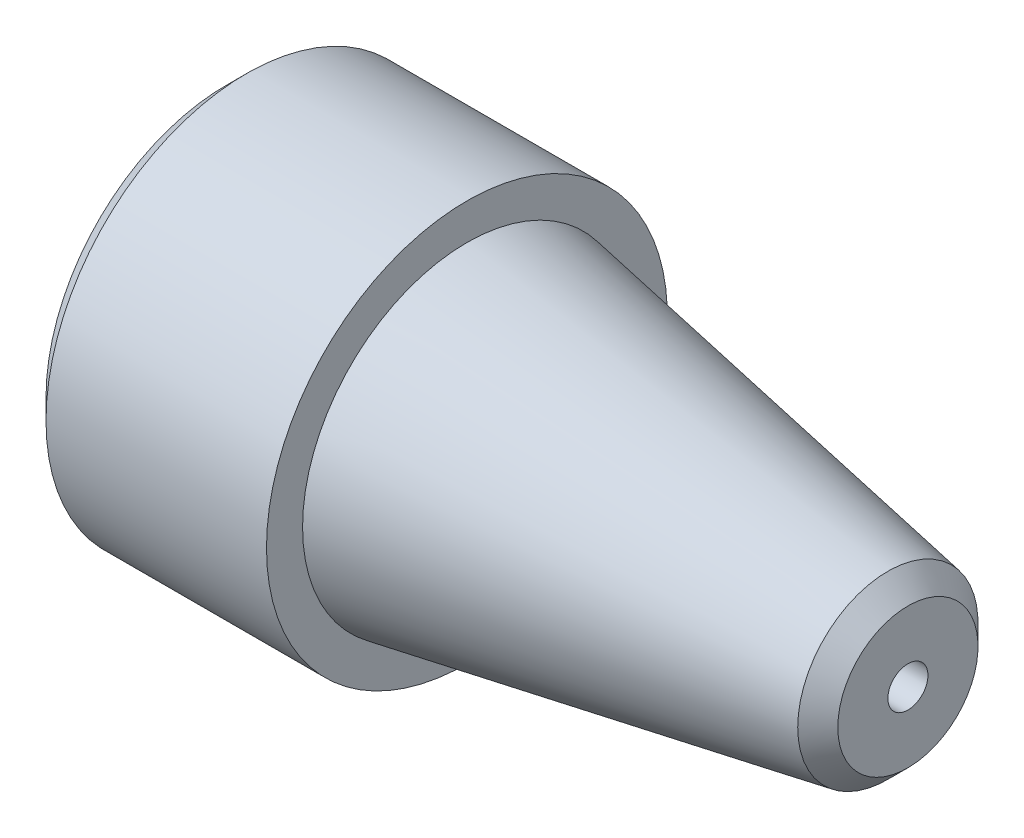
from build123d import *


with BuildPart() as part:
    # Esquisse1 → Révolution1 (revolve)
    with BuildSketch(Plane.XY, mode=Mode.PRIVATE) as r_volution1_sk:
        Polygon((0, 9), (1, 10), (12, 10), (12, 8.2), (33, 4.497133405), (34, 3.497133405), (34, 1), (0, 1), align=None)
    revolve(r_volution1_sk.sketch.rotate(Axis((-9.576652971, 0, 0), (1, 0, 0)), 90), axis=Axis((-9.576652971, 0, 0), (1, 0, 0)))


solid = part.part
